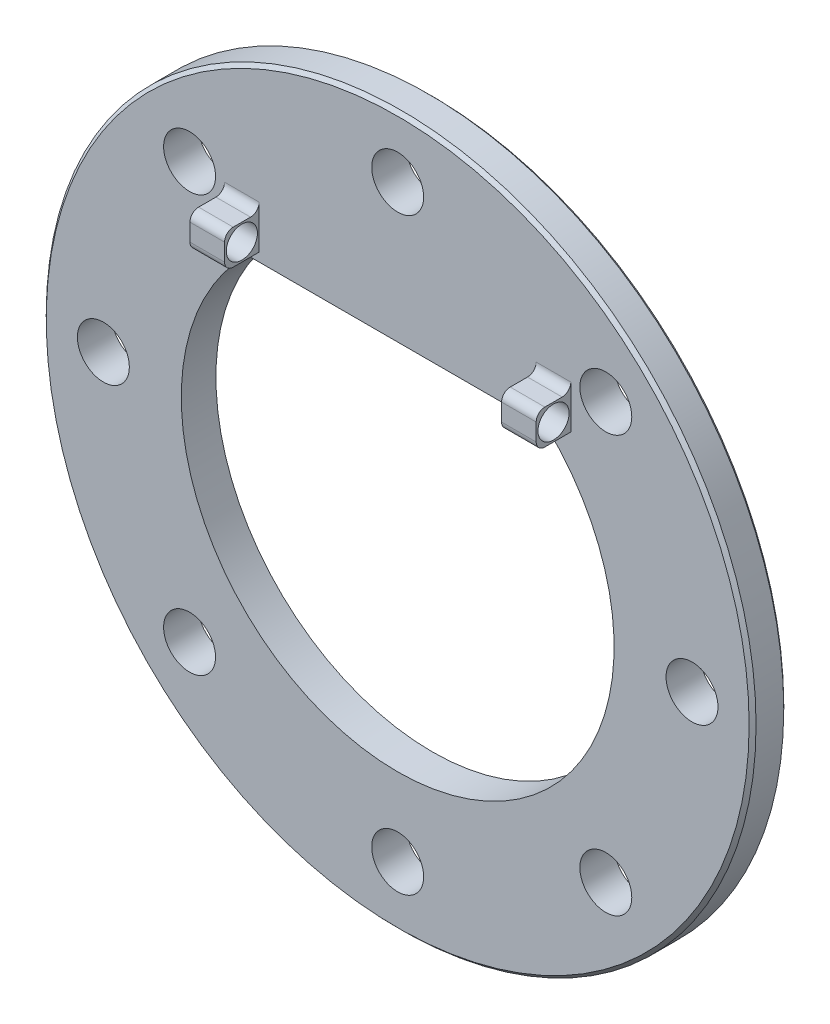
from build123d import *

# Parameters (mm, degrees)
SKETCH1_R                      = 205
SKETCH1_R_2                    = 15
BOSS_EXTRUDE1_DEPTH            = 20
CHAMFER1_SIZE                  = 2
CUT_EXTRUDE1_DEPTH             = 20
SKETCH4_W                      = 20
SKETCH4_H                      = 20
BOSS_EXTRUDE2_DEPTH            = 20
CUT_EXTRUDE3_REACH             = 294.66
SKETCH5_R                      = 9
CUT_EXTRUDE3_DIRECTION_2_REACH = 294.66
FILLET1_R                      = 5


with BuildPart() as part:
    # Sketch1 → Boss-Extrude1 (new body)
    with BuildSketch(Plane.XY):
        Circle(SKETCH1_R)
        with Locations((0, 170)):
            Circle(SKETCH1_R_2, mode=Mode.SUBTRACT)
        with Locations((120.208152802, 120.208152802)):
            Circle(SKETCH1_R_2, mode=Mode.SUBTRACT)
        with Locations((170, 0)):
            Circle(SKETCH1_R_2, mode=Mode.SUBTRACT)
        with Locations((120.208152802, -120.208152802)):
            Circle(SKETCH1_R_2, mode=Mode.SUBTRACT)
        with Locations((0, -170)):
            Circle(SKETCH1_R_2, mode=Mode.SUBTRACT)
        with Locations((-120.208152802, -120.208152802)):
            Circle(SKETCH1_R_2, mode=Mode.SUBTRACT)
        with Locations((-170, 0)):
            Circle(SKETCH1_R_2, mode=Mode.SUBTRACT)
        with Locations((-120.208152802, 120.208152802)):
            Circle(SKETCH1_R_2, mode=Mode.SUBTRACT)
    extrude(amount=BOSS_EXTRUDE1_DEPTH)

    # Chamfer1
    chamfer1_edges = [part.edges().sort_by_distance(p)[0] for p in [
        (-205, 0, 0),
        (-205, 0, 20),
    ]]
    chamfer(chamfer1_edges, length=CHAMFER1_SIZE)

    # Sketch2 → Cut-Extrude1 (cut)
    with BuildSketch(Plane.XY.offset(20)):
        with BuildLine():
            Line((-86.746757864, 90), (86.746757864, 90))
            ThreePointArc((86.746757864, 90), (0, -125), (-86.746757864, 90))
        make_face()
    extrude(amount=-CUT_EXTRUDE1_DEPTH, mode=Mode.SUBTRACT)

    # Sketch4 → Boss-Extrude2 (add)
    with BuildSketch(Plane.XY.offset(20)):
        with Locations((-90, 105)):
            Rectangle(SKETCH4_W, SKETCH4_H)
        with Locations((90, 105)):
            Rectangle(SKETCH4_W, SKETCH4_H)
    extrude(amount=BOSS_EXTRUDE2_DEPTH)

    # Cut-Extrude3: up to this face of the body (flat: up to its plane)
    cut_extrude3_end = Plane(part.part.faces().sort_by_distance((-100, 105, 30))[0])
    # Sketch5 → Cut-Extrude3 (cut, up to the picked face)
    with BuildSketch(Plane(origin=(0, 0, 0), x_dir=(0, 0, -1), z_dir=(1, 0, 0)), mode=Mode.PRIVATE) as cut_extrude3_sk1:
        with Locations((-30, 105)):
            Circle(SKETCH5_R)
    cut_extrude3_tool1 = split(extrude(cut_extrude3_sk1.sketch, amount=-CUT_EXTRUDE3_REACH, mode=Mode.PRIVATE), bisect_by=cut_extrude3_end, keep=Keep.BOTH, mode=Mode.PRIVATE)
    add(cut_extrude3_tool1.solids().sort_by(Axis((0, 105, 30), (-1, 0, 0)))[0], mode=Mode.SUBTRACT)

    # Cut-Extrude3 direction 2: up to this face of the body (flat: up to its plane)
    cut_extrude3_direction_2_end = Plane(part.part.faces().sort_by_distance((100, 105, 30))[0])
    # Sketch5 → Cut-Extrude3 direction 2 (cut, up to the picked face)
    with BuildSketch(Plane(origin=(0, 0, 0), x_dir=(0, 0, -1), z_dir=(1, 0, 0)), mode=Mode.PRIVATE) as cut_extrude3_direction_2_sk1:
        with Locations((-30, 105)):
            Circle(SKETCH5_R)
    cut_extrude3_direction_2_tool1 = split(extrude(cut_extrude3_direction_2_sk1.sketch, amount=CUT_EXTRUDE3_DIRECTION_2_REACH, mode=Mode.PRIVATE), bisect_by=cut_extrude3_direction_2_end, keep=Keep.BOTH, mode=Mode.PRIVATE)
    add(cut_extrude3_direction_2_tool1.solids().sort_by(Axis((0, 105, 30), (1, 0, 0)))[0], mode=Mode.SUBTRACT)

    # Fillet1
    fillet1_edges = [part.edges().sort_by_distance(p)[0] for p in [
        (-90, 115, 20),
        (-90, 95, 40),
        (-90, 115, 40),
        (90, 115, 20),
        (90, 115, 40),
        (90, 95, 40),
    ]]
    fillet(fillet1_edges, radius=FILLET1_R)


solid = part.part
